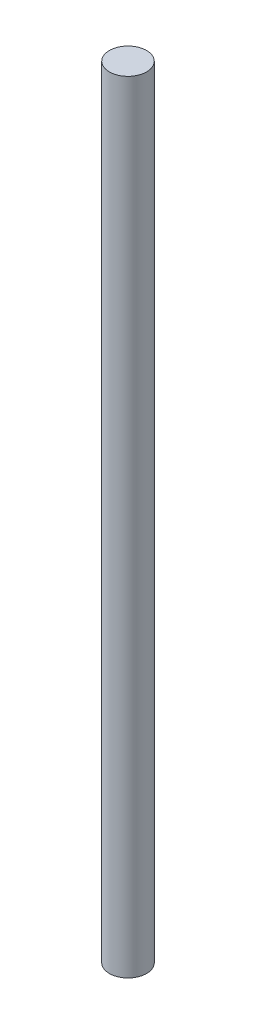
from build123d import *

# Parameters (mm, degrees)
ESBO_O1_R                = 10
RESSALTO_EXTRUS_O1_DEPTH = 420


with BuildPart() as part:
    # Esboço1 → Ressalto-extrusão1 (new body)
    with BuildSketch(Plane(origin=(0, 0, 0), x_dir=(1, 0, 0), z_dir=(0, 1, 0))):
        with Locations(Location((0, 0, 0), (0, 0, 270))):
            Circle(ESBO_O1_R)
    extrude(amount=RESSALTO_EXTRUS_O1_DEPTH)


solid = part.part
